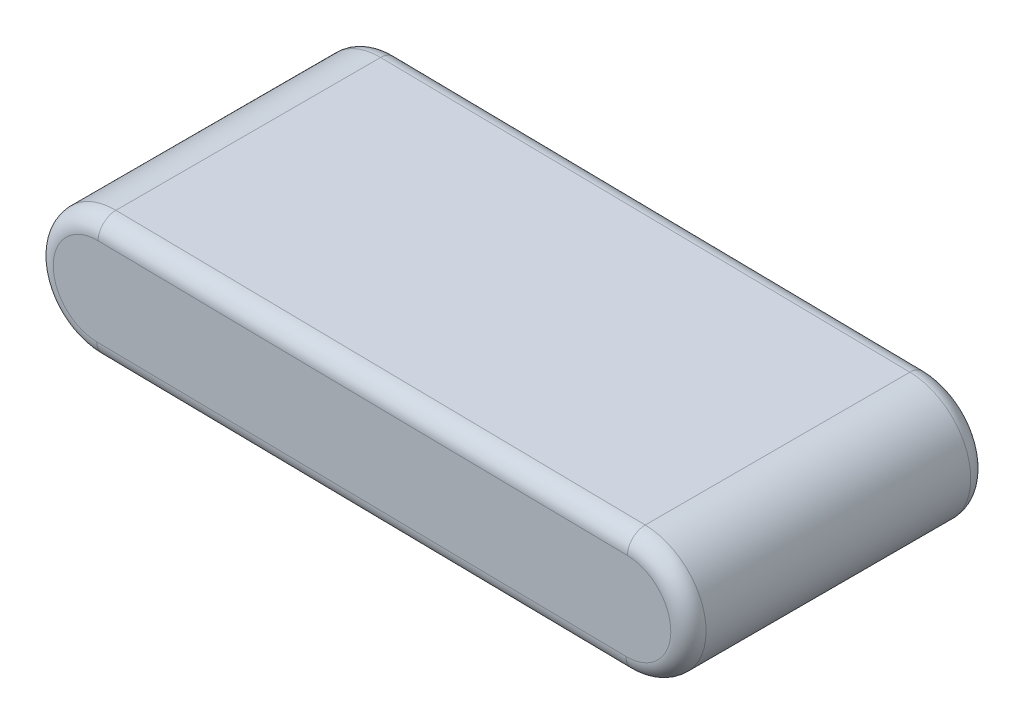
from build123d import *

# Parameters (mm, degrees)
RESSALTO_EXTRUS_O1_DEPTH = 17
FILETE1_R                = 1


with BuildPart() as part:
    # Esboço1 → Ressalto-extrusão1 (new body)
    with BuildSketch(Plane.XY):
        with BuildLine():
            Line((-14.947871578, 3.723044087), (15.052128422, 3.276179478))
            ThreePointArc((15.052128422, 3.276179478), (18.499611782, -0.275560726), (14.947871578, -3.723044087))
            Line((14.947871578, -3.723044087), (-15.052128422, -3.276179478))
            ThreePointArc((-15.052128422, -3.276179478), (-18.499611782, 0.275560726), (-14.947871578, 3.723044087))
        make_face()
    extrude(amount=RESSALTO_EXTRUS_O1_DEPTH)

    # Filete1
    filete1_edges = [part.edges().sort_by_distance(p)[0] for p in [
        (18.499611782, -0.275560726, 17),
        (0.052128422, 3.499611782, 17),
        (-18.499611782, 0.275560726, 17),
        (0.052128422, 3.499611782, 0),
        (18.499611782, -0.275560726, 0),
        (-0.052128422, -3.499611782, 0),
        (-18.499611782, 0.275560726, 0),
        (-0.052128422, -3.499611782, 17),
    ]]
    fillet(filete1_edges, radius=FILETE1_R)


solid = part.part
